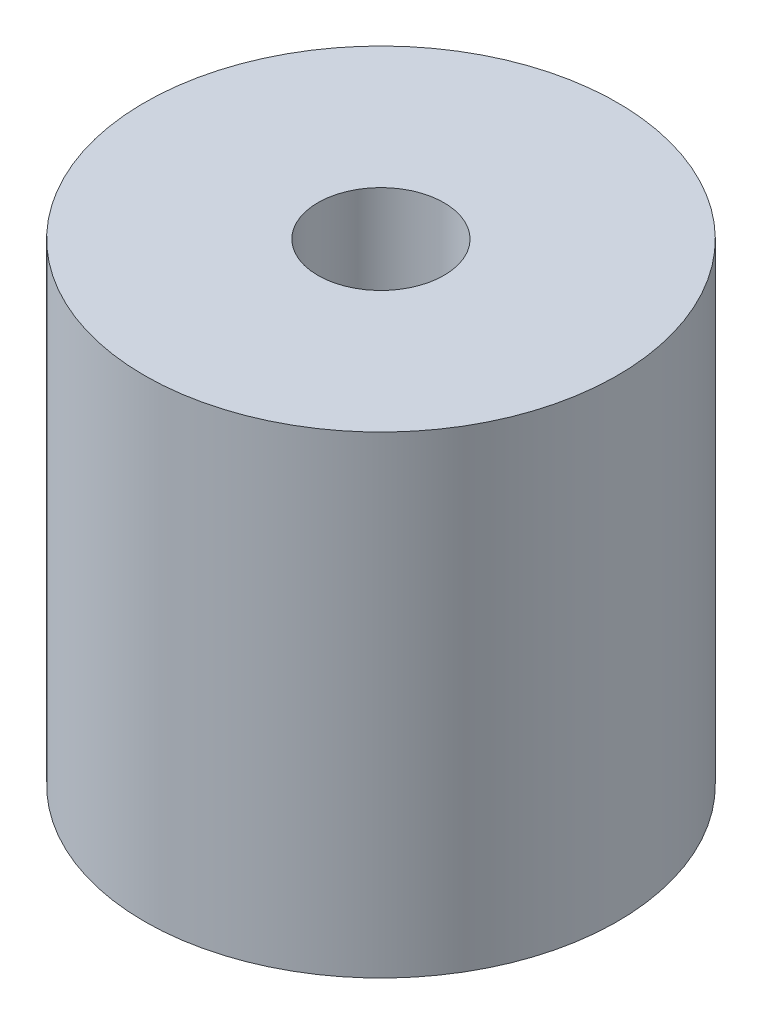
from build123d import *

# Parameters (mm, degrees)
CROQUIS1_R              = 15
SALIENTE_EXTRUIR1_DEPTH = 30
CORTAR_EXTRUIR1_REACH   = 38.742
CROQUIS2_R              = 4


with BuildPart() as part:
    # Croquis1 → Saliente-Extruir1 (new body)
    with BuildSketch(Plane(origin=(0, 0, 0), x_dir=(1, 0, 0), z_dir=(0, 1, 0))):
        with Locations(Location((0, 0, 0), (0, 0, 270))):
            Circle(CROQUIS1_R)
    extrude(amount=SALIENTE_EXTRUIR1_DEPTH)

    # Croquis2 → Cortar-Extruir1 (cut, up to next)
    with BuildSketch(Plane(origin=(0, 30, 0), x_dir=(1, 0, 0), z_dir=(0, 1, 0)), mode=Mode.PRIVATE) as cortar_extruir1_sk1:
        with Locations(Location((0, 0, 0), (0, 0, 270))):
            Circle(CROQUIS2_R)
    cortar_extruir1_tool1 = extrude(cortar_extruir1_sk1.sketch, amount=-CORTAR_EXTRUIR1_REACH, mode=Mode.PRIVATE) & part.part
    add(cortar_extruir1_tool1.solids().sort_by_distance((0, 30, 0))[0], mode=Mode.SUBTRACT)


solid = part.part
